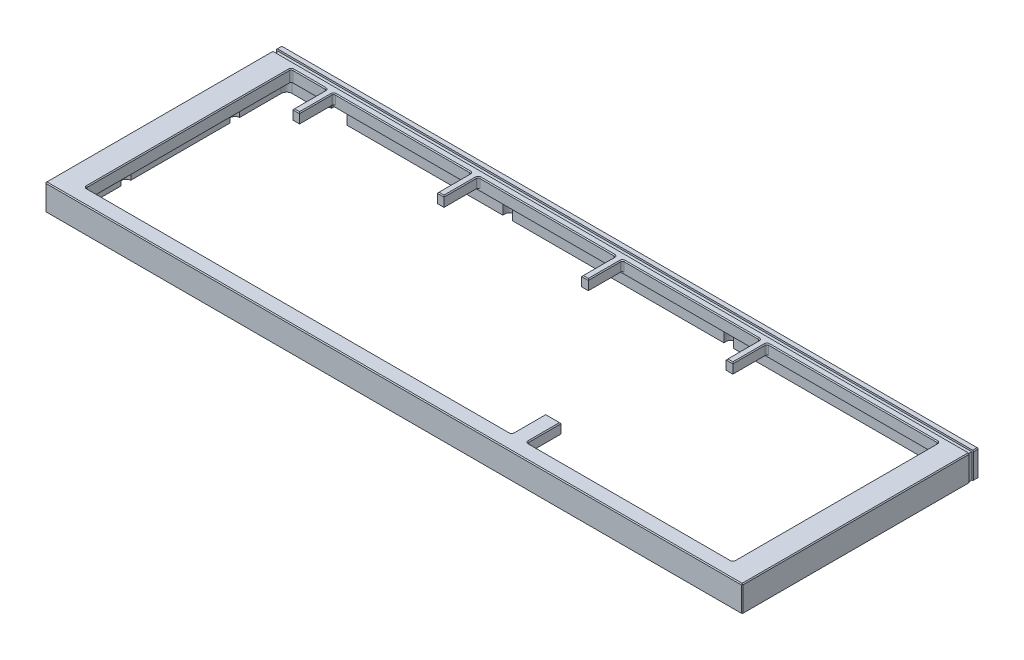
from build123d import *

# Parameters (mm, degrees)
SKETCH1_W                 = 390.74
SKETCH1_H                 = 132.7
SKETCH1_W_2               = 362.9
SKETCH1_H_2               = 115.3
MAIN_BODY_DEPTH           = 14.8
SKETCH2_W                 = 386.74
SKETCH2_H                 = 128.7
ALIGNMENT_GUIDE_DEPTH     = 1
SKETCH3_W                 = 8.7
SKETCH3_H                 = 19.1
SKETCH3_W_2               = 3.8
BLOCKERS_DEPTH            = 5.5
FILLET5_R                 = 1
SKETCH4_W                 = 371.8
SKETCH4_H                 = 119.1
PCB_CUTOUT_DEPTH          = 7.3
FILLET4_R                 = 3
PLATETABS_DEPTH           = 7.3
USB_CUTOUT_REACH          = 414.924
SKETCH9_W                 = 12
SKETCH9_H                 = 3.2
SKETCH11_W                = 15
SKETCH11_H                = 7.3
PCB_CLEARANCE_DEPTH       = 3.9
FILLET7_R                 = 2.5
CHAMFER1_SIZE             = 0.5
CHAMFER2_SIZE             = 0.5
SKETCH27_W                = 390.74
SKETCH27_H                = 2.5
CUT_EXTRUDE11_DEPTH       = 1
SKETCH28_W                = 1
SKETCH28_H                = 2.5
CUT_EXTRUDE12_DEPTH       = 413.889183196
M3X0_5_TAPPED_HOLE1_D     = 2.5
M3X0_5_TAPPED_HOLE1_DEPTH = 4
M3X0_5_TAPPED_HOLE1_TIP   = 0.751075774
M2X0_4_TAPPED_HOLE1_D     = 1.6
M2X0_4_TAPPED_HOLE1_DEPTH = 4
M2X0_4_TAPPED_HOLE1_TIP   = 0.480688495
FILLET8_R                 = 0.1


with BuildPart() as part:
    # Sketch1 → Main Body (new body)
    with BuildSketch(Plane(origin=(0, 0, 0), x_dir=(1, 0, 0), z_dir=(0, 1, 0))):
        with Locations((195.37, 66.35)):
            Rectangle(SKETCH1_W, SKETCH1_H)
        with Locations((195.37, 66.35)):
            Rectangle(SKETCH1_W_2, SKETCH1_H_2, mode=Mode.SUBTRACT)
    extrude(amount=MAIN_BODY_DEPTH)

    # Sketch2 → Alignment Guide (cut)
    with BuildSketch(Plane.XZ):
        with Locations((195.37, -66.35)):
            Rectangle(SKETCH2_W, SKETCH2_H)
    extrude(amount=-ALIGNMENT_GUIDE_DEPTH, mode=Mode.SUBTRACT)

    # Sketch3 → Blockers (add)
    with BuildSketch(Plane(origin=(0, 14.8, 0), x_dir=(1, 0, 0), z_dir=(0, 1, 0))):
        with Locations((257.17, 18.25)):
            Rectangle(SKETCH3_W, SKETCH3_H)
        with Locations((35.82, 114.45)):
            Rectangle(SKETCH3_W_2, SKETCH3_H)
        with Locations((116.82, 114.45)):
            Rectangle(SKETCH3_W_2, SKETCH3_H)
        with Locations((197.72, 114.45)):
            Rectangle(SKETCH3_W_2, SKETCH3_H)
        with Locations((278.72, 114.45)):
            Rectangle(SKETCH3_W_2, SKETCH3_H)
    extrude(amount=-BLOCKERS_DEPTH)

    # Fillet5
    fillet5_edges = [part.edges().sort_by_distance(p)[0] for p in [
        (13.92, 7.9, -124),
        (13.92, 7.9, -8.7),
        (376.82, 7.9, -8.7),
        (376.82, 7.9, -124),
        (252.82, 12.05, -8.7),
        (261.52, 12.05, -8.7),
        (33.92, 12.05, -124),
        (37.72, 12.05, -124),
        (114.92, 12.05, -124),
        (118.72, 12.05, -124),
        (195.82, 12.05, -124),
        (199.62, 12.05, -124),
        (276.82, 12.05, -124),
        (280.62, 12.05, -124),
    ]]
    fillet(fillet5_edges, radius=FILLET5_R)

    # Sketch4 → PCB Cutout (cut)
    with BuildSketch(Plane.XZ.offset(-1)):
        with Locations((195.37, -66.35)):
            Rectangle(SKETCH4_W, SKETCH4_H)
    extrude(amount=-PCB_CUTOUT_DEPTH, mode=Mode.SUBTRACT)

    # Fillet4
    fillet4_edges = [part.edges().sort_by_distance(p)[0] for p in [
        (381.27, 4.65, -6.8),
        (381.27, 4.65, -125.9),
        (9.47, 4.65, -125.9),
        (9.47, 4.65, -6.8),
        (2, 0.5, -2),
        (388.74, 0.5, -2),
        (388.74, 0.5, -130.7),
        (2, 0.5, -130.7),
    ]]
    fillet(fillet4_edges, radius=FILLET4_R)

    # Sketch6 → PlateTabs (cut)
    with BuildSketch(Plane.XZ.offset(-1)):
        with BuildLine():
            ThreePointArc((381.27, -99.59271763), (383.084013406, -98.722498331), (383.82, -96.85))
            ThreePointArc((383.82, -96.85), (383.084013406, -94.977501669), (381.27, -94.10728237))
            Line((381.27, -94.10728237), (381.27, -99.59271763))
        make_face()
        with BuildLine():
            Line((381.27, -99.59271763), (381.27, -94.10728237))
            ThreePointArc((381.27, -94.10728237), (378.32, -96.85), (381.27, -99.59271763))
        make_face()
        with BuildLine():
            ThreePointArc((381.27, -33.10728237), (378.32, -35.85), (381.27, -38.59271763))
            Line((381.27, -38.59271763), (381.27, -33.10728237))
        make_face()
        with BuildLine():
            Line((381.27, -33.10728237), (381.27, -38.59271763))
            ThreePointArc((381.27, -38.59271763), (383.084013406, -37.722498331), (383.82, -35.85))
            ThreePointArc((383.82, -35.85), (383.084013406, -33.977501669), (381.27, -33.10728237))
        make_face()
        with BuildLine():
            Line((254.59, -6.8), (255.452541391, -6.8))
            ThreePointArc((255.452541391, -6.8), (254.814825632, -5.889033706), (254.59, -4.8))
            Line((254.59, -4.8), (254.59, -6.8))
        make_face()
        with BuildLine():
            Line((255.452541391, -6.8), (259.227458609, -6.8))
            ThreePointArc((259.227458609, -6.8), (259.865174368, -5.889033706), (260.09, -4.8))
            Line((260.09, -4.8), (254.59, -4.8))
            ThreePointArc((254.59, -4.8), (254.814825632, -5.889033706), (255.452541391, -6.8))
        make_face()
        with BuildLine():
            Line((259.227458609, -6.8), (260.09, -6.8))
            Line((260.09, -6.8), (260.09, -4.8))
            ThreePointArc((260.09, -4.8), (259.865174368, -5.889033706), (259.227458609, -6.8))
        make_face()
        with BuildLine():
            Line((254.59, -4.8), (260.09, -4.8))
            ThreePointArc((260.09, -4.8), (257.34, -2.05), (254.59, -4.8))
        make_face()
        with BuildLine():
            Line((260.09, -127.1), (254.59, -127.1))
            ThreePointArc((254.59, -127.1), (257.34, -129.85), (260.09, -127.1))
        make_face()
        with BuildLine():
            ThreePointArc((254.865631394, -125.9), (254.659793509, -126.484375791), (254.59, -127.1))
            Line((254.59, -127.1), (260.09, -127.1))
            ThreePointArc((260.09, -127.1), (260.020206491, -126.484375791), (259.814368606, -125.9))
            Line((259.814368606, -125.9), (254.865631394, -125.9))
        make_face()
        with BuildLine():
            Line((254.59, -125.9), (254.59, -127.1))
            ThreePointArc((254.59, -127.1), (254.659793509, -126.484375791), (254.865631394, -125.9))
            Line((254.865631394, -125.9), (254.59, -125.9))
        make_face()
        with BuildLine():
            ThreePointArc((130.65, -127.1), (133.4, -129.85), (136.15, -127.1))
            Line((136.15, -127.1), (130.65, -127.1))
        make_face()
        with BuildLine():
            ThreePointArc((136.15, -127.1), (136.080206491, -126.484375791), (135.874368606, -125.9))
            Line((135.874368606, -125.9), (130.925631394, -125.9))
            ThreePointArc((130.925631394, -125.9), (130.719793509, -126.484375791), (130.65, -127.1))
            Line((130.65, -127.1), (136.15, -127.1))
        make_face()
        with BuildLine():
            ThreePointArc((12.42, -96.85), (11.542498331, -94.835986594), (9.47, -94.10728237))
            Line((9.47, -94.10728237), (9.47, -99.59271763))
            ThreePointArc((9.47, -99.59271763), (11.542498331, -98.864013406), (12.42, -96.85))
        make_face()
        with BuildLine():
            Line((9.47, -99.59271763), (9.47, -94.10728237))
            ThreePointArc((9.47, -94.10728237), (6.92, -96.85), (9.47, -99.59271763))
        make_face()
        with BuildLine():
            ThreePointArc((9.47, -38.59271763), (11.542498331, -37.864013406), (12.42, -35.85))
            ThreePointArc((12.42, -35.85), (11.542498331, -33.835986594), (9.47, -33.10728237))
            Line((9.47, -33.10728237), (9.47, -38.59271763))
        make_face()
        with BuildLine():
            Line((9.47, -38.59271763), (9.47, -33.10728237))
            ThreePointArc((9.47, -33.10728237), (6.92, -35.85), (9.47, -38.59271763))
        make_face()
        with BuildLine():
            Line((130.65, -4.8), (136.15, -4.8))
            ThreePointArc((136.15, -4.8), (133.4, -2.05), (130.65, -4.8))
        make_face()
        with BuildLine():
            ThreePointArc((135.287458609, -6.8), (135.925174368, -5.889033706), (136.15, -4.8))
            Line((136.15, -4.8), (130.65, -4.8))
            ThreePointArc((130.65, -4.8), (130.874825632, -5.889033706), (131.512541391, -6.8))
            Line((131.512541391, -6.8), (135.287458609, -6.8))
        make_face()
        with BuildLine():
            ThreePointArc((259.814368606, -125.9), (260.020206491, -126.484375791), (260.09, -127.1))
            Line((260.09, -127.1), (260.09, -125.9))
            Line((260.09, -125.9), (259.814368606, -125.9))
        make_face()
        with BuildLine():
            ThreePointArc((131.512541391, -6.8), (130.874825632, -5.889033706), (130.65, -4.8))
            Line((130.65, -4.8), (130.65, -6.8))
            Line((130.65, -6.8), (131.512541391, -6.8))
        make_face()
        with BuildLine():
            Line((135.287458609, -6.8), (136.15, -6.8))
            Line((136.15, -6.8), (136.15, -4.8))
            ThreePointArc((136.15, -4.8), (135.925174368, -5.889033706), (135.287458609, -6.8))
        make_face()
        with BuildLine():
            Line((136.15, -127.1), (136.15, -125.9))
            Line((136.15, -125.9), (135.874368606, -125.9))
            ThreePointArc((135.874368606, -125.9), (136.080206491, -126.484375791), (136.15, -127.1))
        make_face()
        with BuildLine():
            ThreePointArc((130.65, -127.1), (130.719793509, -126.484375791), (130.925631394, -125.9))
            Line((130.925631394, -125.9), (130.65, -125.9))
            Line((130.65, -125.9), (130.65, -127.1))
        make_face()
    extrude(amount=-PLATETABS_DEPTH, mode=Mode.SUBTRACT)

    # USB Cutout: up to this face of the body (flat: up to its plane)
    usb_cutout_end = Plane(part.part.faces().sort_by_distance((195.37, 8.660958529, -124))[0])
    # Sketch9 → USB Cutout (cut, up to the picked face)
    with BuildSketch(Plane(origin=(0, 0, -132.7), x_dir=(-1, 0, 0), z_dir=(0, 0, -1)), mode=Mode.PRIVATE) as usb_cutout_sk1:
        with Locations((-35.8, 1.6)):
            Rectangle(SKETCH9_W, SKETCH9_H)
    usb_cutout_tool1 = split(extrude(usb_cutout_sk1.sketch, amount=-USB_CUTOUT_REACH, mode=Mode.PRIVATE), bisect_by=usb_cutout_end, keep=Keep.BOTH, mode=Mode.PRIVATE)
    add(usb_cutout_tool1.solids().sort_by(Axis((35.8, 1.6, -132.7), (0, 0, 1)))[0], mode=Mode.SUBTRACT)

    # Sketch11 → PCB Clearance (cut)
    with BuildSketch(Plane.XY.offset(-125.9)):
        with Locations((35.8, 4.65)):
            Rectangle(SKETCH11_W, SKETCH11_H)
    extrude(amount=-PCB_CLEARANCE_DEPTH, mode=Mode.SUBTRACT)

    # Fillet7
    fillet7_edges = [part.edges().sort_by_distance(p)[0] for p in [
        (28.3, 4.65, -129.8),
        (43.3, 4.65, -129.8),
    ]]
    fillet(fillet7_edges, radius=FILLET7_R)

    # Chamfer1
    chamfer1_edges = [part.edges().sort_by_distance(p)[0] for p in [
        (238.22, 14.8, -124),
        (157.27, 14.8, -124),
        (76.32, 14.8, -124),
        (23.92, 14.8, -124),
        (328.72, 14.8, -124),
        (276.82, 14.8, -113.95),
        (195.82, 14.8, -113.95),
        (114.92, 14.8, -113.95),
        (33.92, 14.8, -113.95),
        (390.74, 14.8, -66.35),
        (13.92, 14.8, -66.35),
        (319.17, 14.8, -8.7),
        (133.37, 14.8, -8.7),
        (261.52, 14.8, -18.75),
        (376.82, 14.8, -66.35),
        (280.912893219, 14.8, -123.707106781),
        (276.527106781, 14.8, -123.707106781),
        (195.527106781, 14.8, -123.707106781),
        (199.912893219, 14.8, -123.707106781),
        (119.012893219, 14.8, -123.707106781),
        (114.627106781, 14.8, -123.707106781),
        (33.627106781, 14.8, -123.707106781),
        (38.012893219, 14.8, -123.707106781),
        (14.212893219, 14.8, -123.707106781),
        (14.212893219, 14.8, -8.992893219),
        (252.527106781, 14.8, -8.992893219),
        (261.812893219, 14.8, -8.992893219),
        (376.527106781, 14.8, -8.992893219),
        (376.527106781, 14.8, -123.707106781),
        (195.37, 14.8, -132.7),
        (0, 14.8, -66.35),
        (252.82, 14.8, -18.75),
        (257.17, 14.8, -27.8),
        (35.82, 14.8, -104.9),
        (37.72, 14.8, -113.95),
        (116.82, 14.8, -104.9),
        (118.72, 14.8, -113.95),
        (197.72, 14.8, -104.9),
        (199.62, 14.8, -113.95),
        (195.37, 14.8, 0),
        (278.72, 14.8, -104.9),
        (280.62, 14.8, -113.95),
    ]]
    chamfer(chamfer1_edges, length=CHAMFER1_SIZE)

    # Chamfer2
    chamfer2_edges = [part.edges().sort_by_distance(p)[0] for p in [
        (14.9, 0, -132.7),
        (216.27, 0, -132.7),
        (390.74, 0, -66.35),
        (0, 7.15, -132.7),
        (390.74, 7.15, -132.7),
        (390.74, 7.15, 0),
        (0, 7.15, 0),
        (195.37, 0, 0),
        (0, 0, -66.35),
    ]]
    chamfer(chamfer2_edges, length=CHAMFER2_SIZE)

    # Sketch27 → Cut-Extrude11 (cut)
    with BuildSketch(Plane(origin=(0, 14.8, 0), x_dir=(1, 0, 0), z_dir=(0, 1, 0))):
        with Locations((195.37, 128.45)):
            Rectangle(SKETCH27_W, SKETCH27_H)
    extrude(amount=-CUT_EXTRUDE11_DEPTH, mode=Mode.SUBTRACT)

    # Sketch28 → Cut-Extrude12 (cut, through all)
    with BuildSketch(Plane(origin=(0, 13.8, 0), x_dir=(1, 0, 0), z_dir=(0, 1, 0))):
        with Locations((0.5, 128.45)):
            Rectangle(SKETCH28_W, SKETCH28_H)
        with Locations((390.24, 128.45)):
            Rectangle(SKETCH28_W, SKETCH28_H)
    extrude(amount=-CUT_EXTRUDE12_DEPTH, mode=Mode.SUBTRACT)

    # M3x0.5 Tapped Hole1
    with Locations(Plane(origin=(385.04, 1, -111.35), x_dir=(0, 0, -1), z_dir=(0, -1, 0))):
        with Locations((0, 0), (-90, 0), (-106.95, -104.3), (-106.95, -275.04), (-90, -379.34), (-45, -379.34), (0, -379.34), (16.95, -275.04), (16.95, -104.3), (-45, 0)):
            Hole(M3X0_5_TAPPED_HOLE1_D / 2, depth=M3X0_5_TAPPED_HOLE1_DEPTH)
            with Locations((0, 0, -(M3X0_5_TAPPED_HOLE1_DEPTH + M3X0_5_TAPPED_HOLE1_TIP / 2))):  # 118° drill point
                Cone(0, M3X0_5_TAPPED_HOLE1_D / 2, M3X0_5_TAPPED_HOLE1_TIP, mode=Mode.SUBTRACT)

    # M2x0.4 Tapped Hole1
    with Locations(Plane(origin=(381.42, 8.3, -96.85), x_dir=(0, 0, -1), z_dir=(0, -1, 0))):
        with Locations((0, 0), (-61, 0), (-92.05, -124.08), (-92.05, -248.02), (-61, -372.1), (0, -372.1), (30.25, -248.02), (30.25, -124.08)):
            Hole(M2X0_4_TAPPED_HOLE1_D / 2, depth=M2X0_4_TAPPED_HOLE1_DEPTH)
            with Locations((0, 0, -(M2X0_4_TAPPED_HOLE1_DEPTH + M2X0_4_TAPPED_HOLE1_TIP / 2))):  # 118° drill point
                Cone(0, M2X0_4_TAPPED_HOLE1_D / 2, M2X0_4_TAPPED_HOLE1_TIP, mode=Mode.SUBTRACT)

    # Fillet8
    fillet8_edges = [part.edges().sort_by_distance(p)[0] for p in [
        (213.77, 0, -130.7),
        (2, 0, -66.35),
        (195.37, 0, -2),
        (388.74, 0, -66.35),
        (2.878679656, 0, -129.821320344),
        (2.878679656, 0, -2.878679656),
        (387.861320344, 0, -2.878679656),
        (387.861320344, 0, -129.821320344),
        (17.4, 0, -130.7),
    ]]
    fillet(fillet8_edges, radius=FILLET8_R)


solid = part.part
